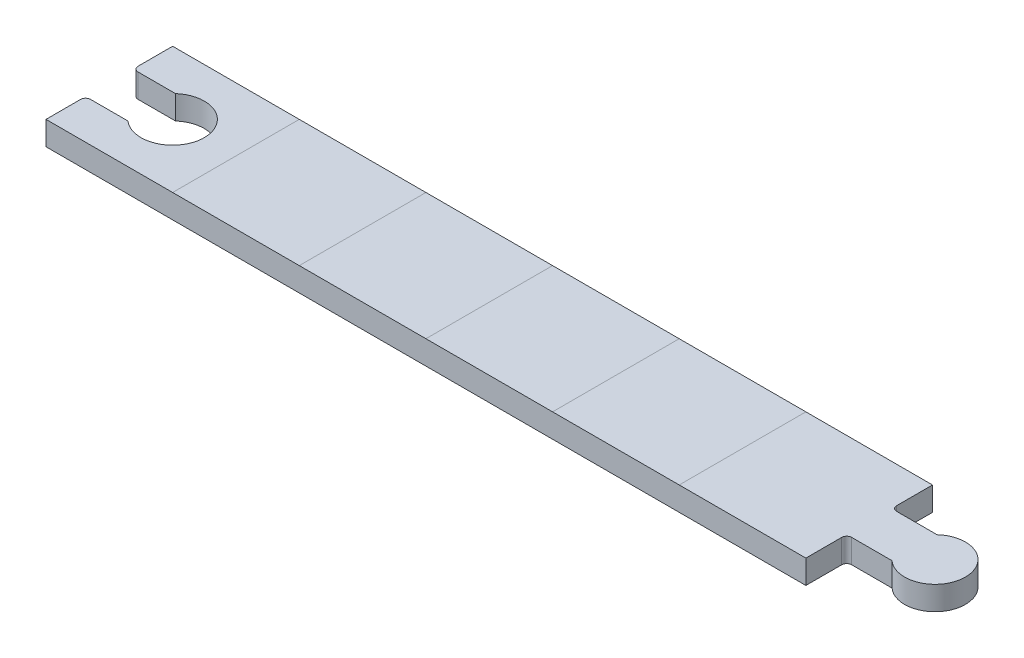
from build123d import *

# Parameters (mm, degrees)
BOSS_EXTRUDE1_DEPTH = 4.7625
FILLET1_R           = 1


with BuildPart() as part:
    # Sketch1 → Boss-Extrude1 (new body)
    with BuildSketch(Plane(origin=(0, 0, 0), x_dir=(1, 0, 0), z_dir=(0, 1, 0))):
        with BuildLine():
            Line((-76.2, -12.7), (76.2, -12.7))
            Line((76.2, -12.7), (76.2, -4.5125))
            Line((76.2, -4.5125), (85.295448411, -4.5125))
            ThreePointArc((85.295448411, -4.5125), (95.5, 0), (85.295448411, 4.5125))
            Line((85.295448411, 4.5125), (76.2, 4.5125))
            Line((76.2, 4.5125), (76.2, 12.7))
            Line((76.2, 12.7), (-76.2, 12.7))
            Line((-76.2, 12.7), (-76.2, 4.7625))
            Line((-76.2, 4.7625), (-67.700130206, 4.7625))
            ThreePointArc((-67.700130206, 4.7625), (-57.15, 0), (-67.700130206, -4.7625))
            Line((-67.700130206, -4.7625), (-76.2, -4.7625))
            Line((-76.2, -4.7625), (-76.2, -12.7))
        make_face()
    extrude(amount=BOSS_EXTRUDE1_DEPTH)

    # Fillet1
    fillet1_edges = [part.edges().sort_by_distance(p)[0] for p in [
        (76.2, 2.38125, -4.5125),
        (76.2, 2.38125, 4.5125),
        (-76.2, 2.38125, 4.7625),
        (-76.2, 2.38125, -4.7625),
    ]]
    fillet(fillet1_edges, radius=FILLET1_R)


solid = part.part
